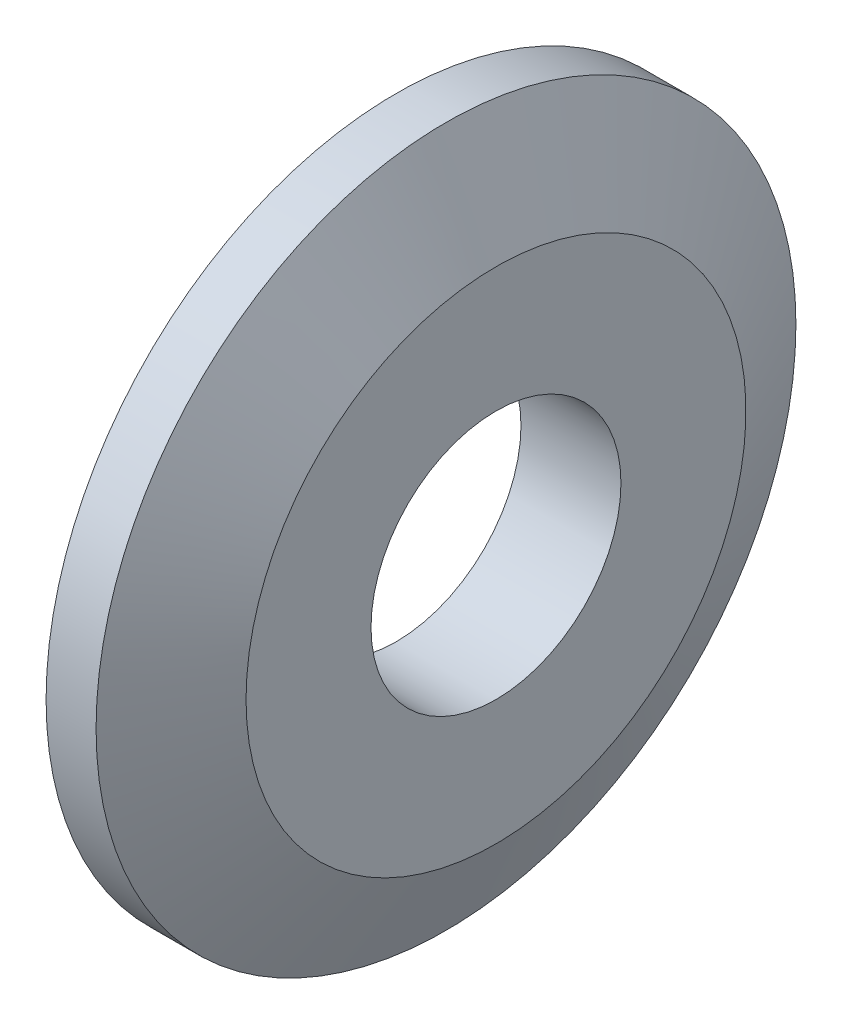
from build123d import *


with BuildPart() as part:
    # Esquisse1 → Révolution1 (revolve)
    with BuildSketch(Plane.XY, mode=Mode.PRIVATE) as r_volution1_sk:
        Polygon((0, 2.5), (0, 7), (1, 7), (2, 5), (2, 2.5), align=None)
    revolve(r_volution1_sk.sketch.rotate(Axis((0, 0, 0), (1, 0, 0)), 90), axis=Axis((0, 0, 0), (1, 0, 0)))


solid = part.part
